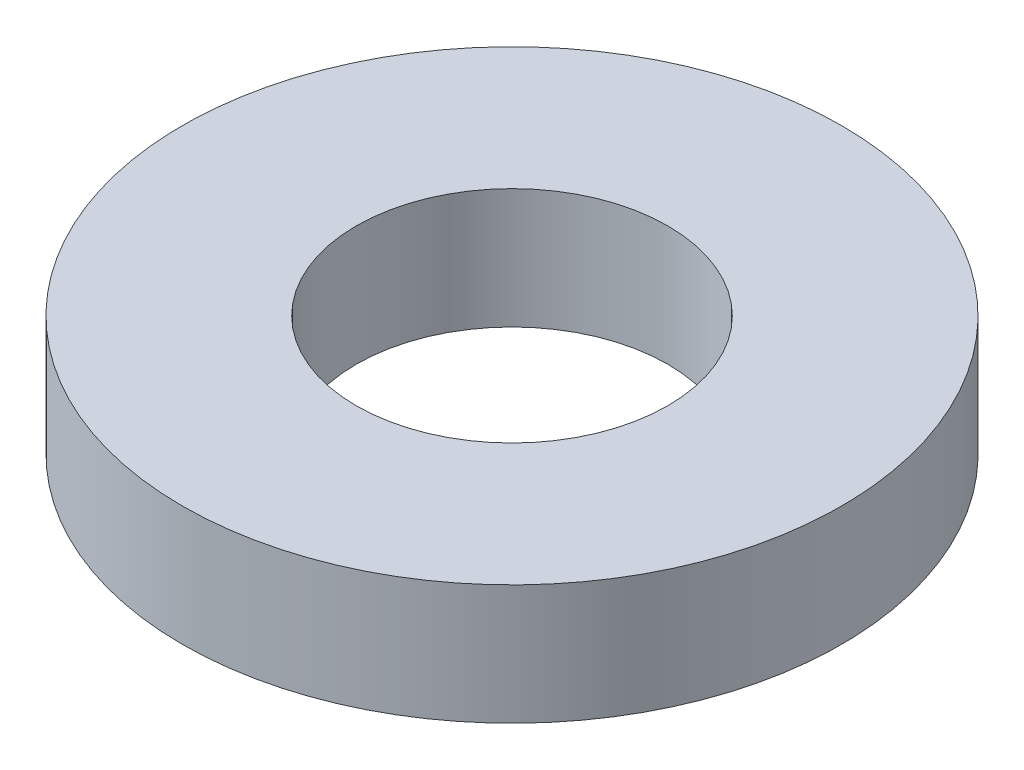
from build123d import *

# Parameters (mm, degrees)
ESQUISSE1_R        = 5.5
ESQUISSE1_R_2      = 2.6
BOSS_EXTRU_1_DEPTH = 2


with BuildPart() as part:
    # Esquisse1 → Boss.-Extru.1 (new body)
    with BuildSketch(Plane(origin=(0, 0, 0), x_dir=(1, 0, 0), z_dir=(0, 1, 0))):
        with Locations(Location((-26.322196577, 4.60165871, 0), (0, 0, 270))):
            Circle(ESQUISSE1_R)
        with Locations(Location((-26.322196577, 4.60165871, 0), (0, 0, 270))):
            Circle(ESQUISSE1_R_2, mode=Mode.SUBTRACT)
    extrude(amount=BOSS_EXTRU_1_DEPTH)


solid = part.part
